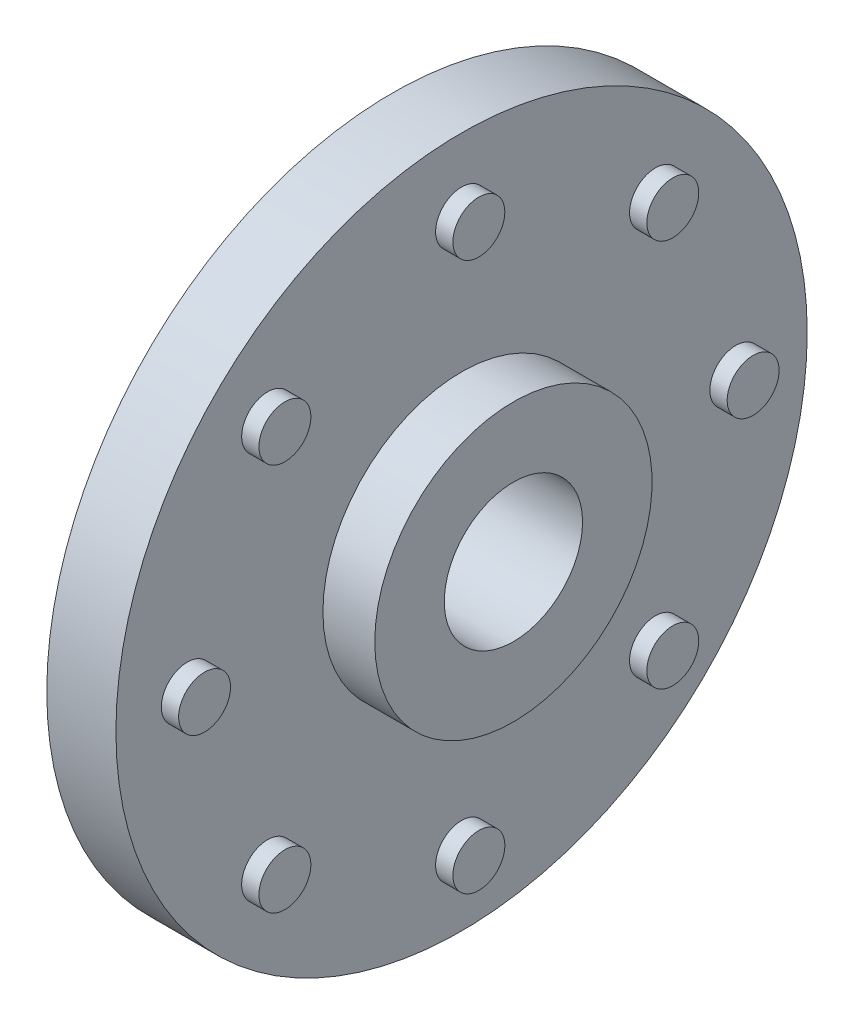
from build123d import *

# Parameters (mm, degrees)
SKETCH1_R           = 127
BOSS_EXTRUDE1_DEPTH = 25.4
SKETCH2_R           = 9.54156828
BOSS_EXTRUDE2_DEPTH = 6.35
CIRPATTERN1_COUNT   = 8
SKETCH3_R           = 50.944165106
BOSS_EXTRUDE3_DEPTH = 19.05
SKETCH4_R           = 25.4
CUT_EXTRUDE1_DEPTH  = 132.334


with BuildPart() as part:
    # Sketch1 → Boss-Extrude1 (new body)
    with BuildSketch(Plane(origin=(0, 0, 0), x_dir=(0, 0, -1), z_dir=(1, 0, 0))):
        Circle(SKETCH1_R)
    extrude(amount=BOSS_EXTRUDE1_DEPTH)

    # Sketch2 → Boss-Extrude2 (add)
    with BuildSketch(Plane(origin=(25.4, 0, 0), x_dir=(0, 0, -1), z_dir=(1, 0, 0))):
        with Locations((0, 100.208781769)):
            Circle(SKETCH2_R)
    boss_extrude2 = extrude(amount=BOSS_EXTRUDE2_DEPTH)

    # CirPattern1: Boss-Extrude2 ×8 about axis
    cirpattern1_axis = Axis((0, -0.568847983, 0), (1, 0, 0))
    for i in range(1, CIRPATTERN1_COUNT):
        add(boss_extrude2.rotate(cirpattern1_axis, i * 360 / CIRPATTERN1_COUNT))

    # Sketch3 → Boss-Extrude3 (add)
    with BuildSketch(Plane(origin=(25.4, 0, 0), x_dir=(0, 0, -1), z_dir=(1, 0, 0))):
        with Locations(Location((0, 0, 0), (0, 0, 180))):
            Circle(SKETCH3_R)
    extrude(amount=BOSS_EXTRUDE3_DEPTH)

    # Sketch4 → Cut-Extrude1 (cut)
    with BuildSketch(Plane(origin=(44.45, 0, 0), x_dir=(0, 0, -1), z_dir=(1, 0, 0))):
        Circle(SKETCH4_R)
    extrude(amount=-CUT_EXTRUDE1_DEPTH, mode=Mode.SUBTRACT)


solid = part.part
